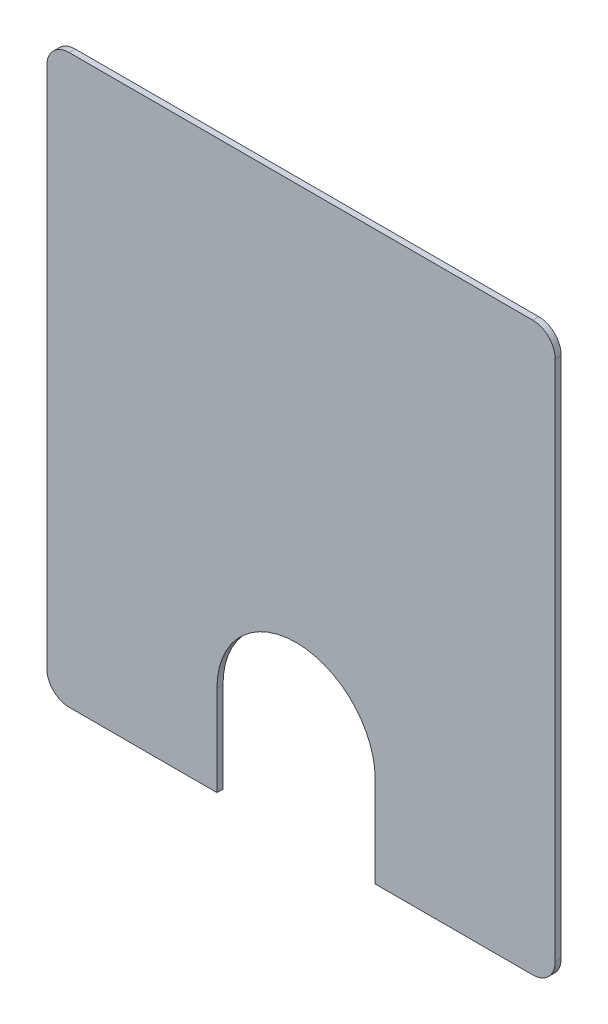
from build123d import *

# Parameters (mm, degrees)
BOSS_EXTRUDE1_DEPTH = 2.7


with BuildPart() as part:
    # Sketch1 → Boss-Extrude1 (new body)
    with BuildSketch(Plane.XY):
        with BuildLine():
            Line((-103.5, 126.6), (103.5, 126.6))
            ThreePointArc((103.5, 126.6), (110.571067812, 123.671067812), (113.5, 116.6))
            Line((113.5, 116.6), (113.5, -116.6))
            ThreePointArc((113.5, -116.6), (110.571067812, -123.671067812), (103.5, -126.6))
            Line((103.5, -126.6), (33.149945785, -126.6))
            Line((33.149945785, -126.6), (33.149945785, -86.203548192))
            ThreePointArc((33.149945785, -86.203548192), (-2.1875, -50.866102407), (-37.524945785, -86.203548192))
            Line((-37.524945785, -86.203548192), (-37.524945785, -126.6))
            Line((-37.524945785, -126.6), (-103.5, -126.6))
            ThreePointArc((-103.5, -126.6), (-110.571067812, -123.671067812), (-113.5, -116.6))
            Line((-113.5, -116.6), (-113.5, 116.6))
            ThreePointArc((-113.5, 116.6), (-110.571067812, 123.671067812), (-103.5, 126.6))
        make_face()
    extrude(amount=BOSS_EXTRUDE1_DEPTH)


solid = part.part
